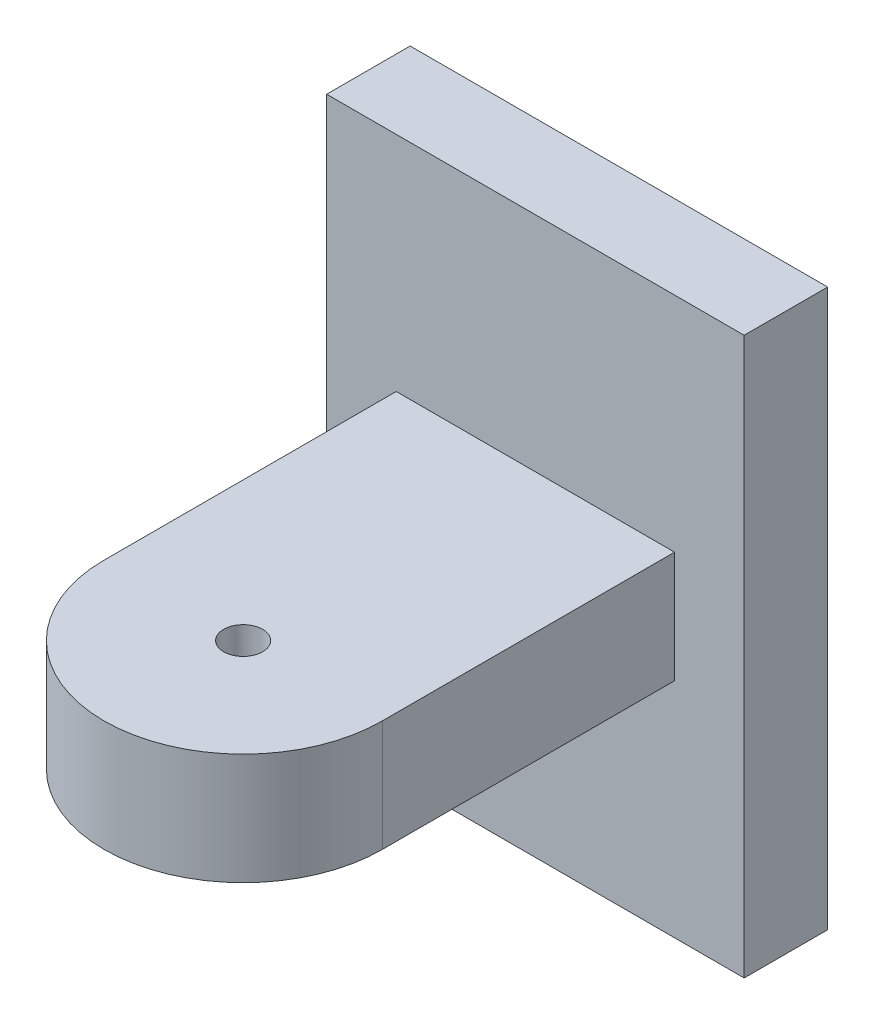
from build123d import *

# Parameters (mm, degrees)
SKETCH1_W           = 15
SKETCH1_H           = 20
BOSS_EXTRUDE1_DEPTH = 3
SKETCH2_R           = 0.7
BOSS_EXTRUDE2_DEPTH = 14
SKETCH2_2_R         = 0.7
CUT_EXTRUDE1_DEPTH  = 6
CUT_EXTRUDE2_START  = -2
CUT_EXTRUDE2_DEPTH  = 2
CUT_EXTRUDE3_DEPTH  = 2


with BuildPart() as part:
    # Sketch1 → Boss-Extrude1 (new body)
    with BuildSketch(Plane.XY):
        Rectangle(SKETCH1_W, SKETCH1_H)
    extrude(amount=BOSS_EXTRUDE1_DEPTH)

    # Sketch2 → Boss-Extrude2 (add)
    with BuildSketch(Plane(origin=(0, 10, 0), x_dir=(1, 0, 0), z_dir=(0, 1, 0))):
        with BuildLine():
            Line((-5, -3), (-5, -13.5))
            ThreePointArc((-5, -13.5), (0, -18.5), (5, -13.5))
            Line((5, -13.5), (5, -3))
            Line((5, -3), (-5, -3))
        make_face()
        with Locations((0, -13.5)):
            Circle(SKETCH2_R, mode=Mode.SUBTRACT)
    extrude(amount=-BOSS_EXTRUDE2_DEPTH)

    # Sketch2<2> → Cut-Extrude1 (cut)
    with BuildSketch(Plane(origin=(0, 10, 0), x_dir=(1, 0, 0), z_dir=(0, 1, 0))):
        with BuildLine():
            Line((-5, -3), (-5, -13.5))
            ThreePointArc((-5, -13.5), (0, -18.5), (5, -13.5))
            Line((5, -13.5), (5, -3))
            Line((5, -3), (-5, -3))
        make_face()
        with Locations((0, -13.5)):
            Circle(SKETCH2_2_R, mode=Mode.SUBTRACT)
    extrude(amount=-CUT_EXTRUDE1_DEPTH, mode=Mode.SUBTRACT)

    # Sketch3 → Cut-Extrude2 (cut)
    with BuildSketch(Plane.XZ.offset(4).offset(CUT_EXTRUDE2_START)):
        with BuildLine():
            Line((5, 13.5), (5, 3))
            Line((5, 3), (-5, 3))
            Line((-5, 3), (-5, 13.5))
            ThreePointArc((-5, 13.5), (0, 18.5), (5, 13.5))
        make_face()
    extrude(amount=CUT_EXTRUDE2_DEPTH, mode=Mode.SUBTRACT)

    # Sketch4 → Cut-Extrude3 (cut)
    with BuildSketch(Plane(origin=(0, 4, 0), x_dir=(1, 0, 0), z_dir=(0, 1, 0))):
        with BuildLine():
            Line((-5, -13.5), (-5, -3))
            Line((-5, -3), (5, -3))
            Line((5, -3), (5, -13.5))
            ThreePointArc((5, -13.5), (0, -18.5), (-5, -13.5))
        make_face()
    extrude(amount=-CUT_EXTRUDE3_DEPTH, mode=Mode.SUBTRACT)


solid = part.part
